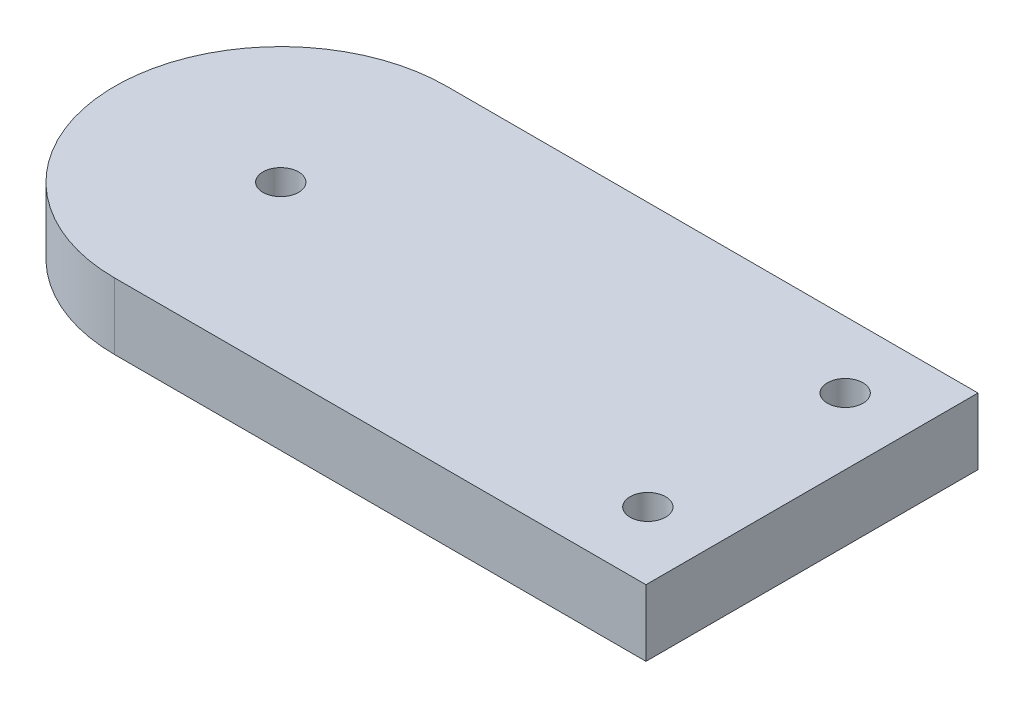
from build123d import *

# Parameters (mm, degrees)
SKETCH2_R           = 0.8509
BOSS_EXTRUDE1_DEPTH = 3.175


with BuildPart() as part:
    # Sketch2 → Boss-Extrude1 (new body)
    with BuildSketch(Plane(origin=(0, 0, 0), x_dir=(1, 0, 0), z_dir=(0, 1, 0))):
        with BuildLine():
            Line((0, 0), (0, 15.875))
            Line((0, 15.875), (-25.4, 15.875))
            ThreePointArc((-25.4, 15.875), (-33.3375, 7.9375), (-25.4, 0))
            Line((-25.4, 0), (0, 0))
        make_face()
        with Locations(Location((-25.4, 7.9375, 0), (0, 0, 270))):
            Circle(SKETCH2_R, mode=Mode.SUBTRACT)
        with Locations(Location((-3.175, 12.7, 0), (0, 0, 270))):
            Circle(SKETCH2_R, mode=Mode.SUBTRACT)
        with Locations(Location((-3.175, 3.2639, 0), (0, 0, 270))):
            Circle(SKETCH2_R, mode=Mode.SUBTRACT)
    extrude(amount=BOSS_EXTRUDE1_DEPTH)


solid = part.part
